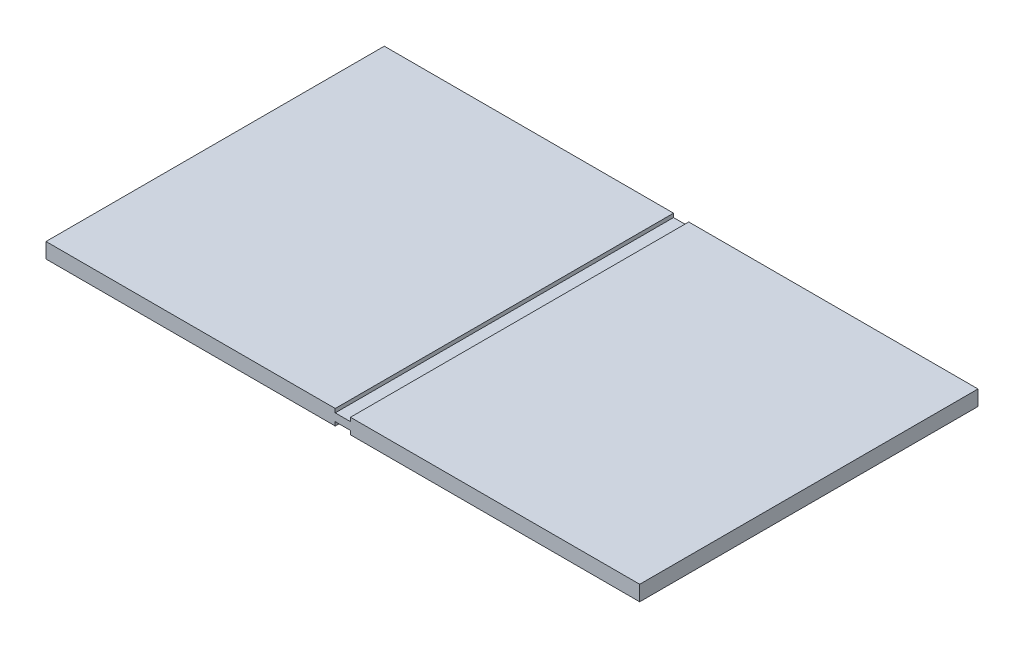
from build123d import *

# Parameters (mm, degrees)
SKETCH1_W           = 702
SKETCH1_H           = 400
BOSS_EXTRUDE1_DEPTH = 18
SKETCH2_W           = 18
SKETCH2_H           = 400
CUT_EXTRUDE1_DEPTH  = 4.5
SKETCH3_W           = 18
SKETCH3_H           = 400
CUT_EXTRUDE2_DEPTH  = 4.5


with BuildPart() as part:
    # Sketch1 → Boss-Extrude1 (new body)
    with BuildSketch(Plane(origin=(0, 0, 0), x_dir=(1, 0, 0), z_dir=(0, 1, 0))):
        Rectangle(SKETCH1_W, SKETCH1_H)
    extrude(amount=BOSS_EXTRUDE1_DEPTH)

    # Sketch2 → Cut-Extrude1 (cut)
    with BuildSketch(Plane(origin=(0, 18, 0), x_dir=(1, 0, 0), z_dir=(0, 1, 0))):
        Rectangle(SKETCH2_W, SKETCH2_H)
    extrude(amount=-CUT_EXTRUDE1_DEPTH, mode=Mode.SUBTRACT)

    # Sketch3 → Cut-Extrude2 (cut)
    with BuildSketch(Plane(origin=(0, 0, 0), x_dir=(-1, 0, 0), z_dir=(0, -1, 0))):
        Rectangle(SKETCH3_W, SKETCH3_H)
    extrude(amount=-CUT_EXTRUDE2_DEPTH, mode=Mode.SUBTRACT)


solid = part.part
